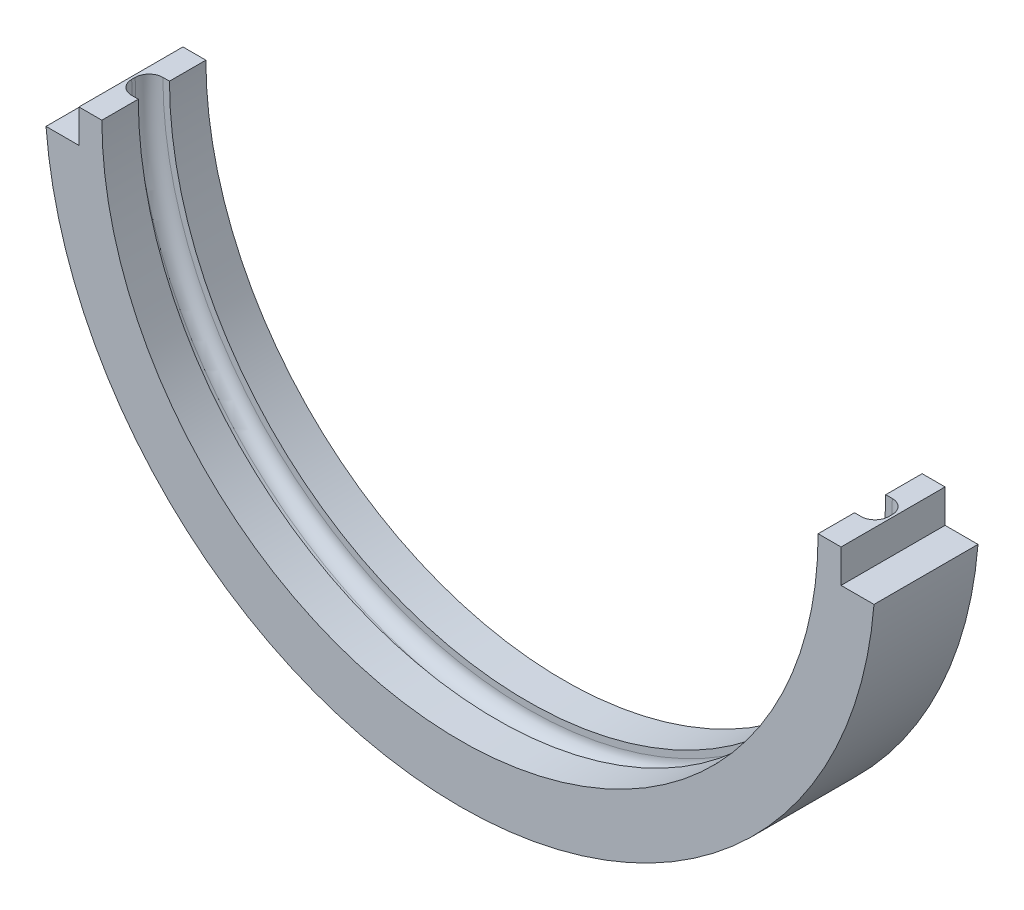
from build123d import *

# Parameters (mm, degrees)
BOSS_EXTRUDE1_DEPTH = 5.715
BOSS_EXTRUDE2_DEPTH = 6.6675
BOSS_EXTRUDE3_START = 6.6675
BOSS_EXTRUDE3_DEPTH = 6.6675
FILLET1_R           = 2.54
SKETCH5_R           = 1.524
CUT_EXTRUDE1_DEPTH  = 6.35
SKETCH6_W           = 6.0325
SKETCH6_H           = 6.096
CUT_EXTRUDE2_DEPTH  = 110.257060148
SKETCH7_W           = 13.176307298
SKETCH7_H           = 9.310122243
CUT_EXTRUDE3_DEPTH  = 110.257060009


with BuildPart() as part:
    # Sketch1 → Boss-Extrude1 (new body)
    with BuildSketch(Plane.XY):
        with BuildLine():
            ThreePointArc((69.342, 76.073), (0, 6.731), (-69.342, 76.073))
            Line((-69.342, 76.073), (-76.073, 76.073))
            ThreePointArc((-76.073, 76.073), (0, 0), (76.073, 76.073))
            Line((76.073, 76.073), (69.342, 76.073))
        make_face()
    extrude(amount=BOSS_EXTRUDE1_DEPTH)

    # Sketch3 → Boss-Extrude2 (add)
    with BuildSketch(Plane.XY.offset(5.715)):
        with BuildLine():
            ThreePointArc((65.5955, 76.073), (0, 10.4775), (-65.5955, 76.073))
            Line((-65.5955, 76.073), (-69.342, 76.073))
            ThreePointArc((-69.342, 76.073), (0, 6.731), (69.342, 76.073))
            Line((69.342, 76.073), (65.5955, 76.073))
        make_face()
        with BuildLine():
            Line((76.073, 76.073), (69.342, 76.073))
            ThreePointArc((69.342, 76.073), (0, 6.731), (-69.342, 76.073))
            Line((-69.342, 76.073), (-76.073, 76.073))
            ThreePointArc((-76.073, 76.073), (0, 0), (76.073, 76.073))
        make_face()
    extrude(amount=BOSS_EXTRUDE2_DEPTH)

    # Sketch4 → Boss-Extrude3 (add)
    with BuildSketch(Plane(origin=(0, 0, 0), x_dir=(-1, 0, 0), z_dir=(0, 0, -1)).offset(BOSS_EXTRUDE3_START)):
        with BuildLine():
            ThreePointArc((65.5955, 76.073), (0, 10.4775), (-65.5955, 76.073))
            Line((-65.5955, 76.073), (-69.342, 76.073))
            ThreePointArc((-69.342, 76.073), (0, 6.731), (69.342, 76.073))
            Line((69.342, 76.073), (65.5955, 76.073))
        make_face()
        with BuildLine():
            Line((76.073, 76.073), (69.342, 76.073))
            ThreePointArc((69.342, 76.073), (0, 6.731), (-69.342, 76.073))
            Line((-69.342, 76.073), (-76.073, 76.073))
            ThreePointArc((-76.073, 76.073), (0, 0), (76.073, 76.073))
        make_face()
    extrude(amount=-BOSS_EXTRUDE3_DEPTH)

    # Fillet1
    fillet1_edges = [part.edges().sort_by_distance(p)[0] for p in [
        (0, 6.731, 5.715),
        (0, 6.731, 0),
    ]]
    fillet(fillet1_edges, radius=FILLET1_R)

    # Sketch5 → Cut-Extrude1 (cut)
    with BuildSketch(Plane(origin=(0, 0, 0), x_dir=(1, 0, 0), z_dir=(0, 1, 0))):
        with Locations(Location((0, -2.8575, 0), (0, 0, 90))):
            Circle(SKETCH5_R)
    extrude(amount=CUT_EXTRUDE1_DEPTH, mode=Mode.SUBTRACT)

    # Sketch6 → Cut-Extrude2 (cut, through all)
    with BuildSketch(Plane.XY.offset(12.3825)):
        with BuildLine():
            Line((-82.07762594, 69.977), (-75.828359556, 69.977))
            ThreePointArc((-75.828359556, 69.977), (-76.011815284, 73.022546552), (-76.073, 76.073))
            Line((-76.073, 76.073), (-82.07762594, 76.073))
            Line((-82.07762594, 76.073), (-82.07762594, 69.977))
        make_face()
        with Locations((-72.812109556, 73.025)):
            Rectangle(SKETCH6_W, SKETCH6_H)
        with BuildLine():
            ThreePointArc((76.073, 76.073), (76.011815284, 73.022546552), (75.828359556, 69.977))
            Line((75.828359556, 69.977), (82.07762594, 69.977))
            Line((82.07762594, 69.977), (82.07762594, 76.073))
            Line((82.07762594, 76.073), (76.073, 76.073))
        make_face()
        with Locations((72.812109556, 73.025)):
            Rectangle(SKETCH6_W, SKETCH6_H)
    extrude(amount=-CUT_EXTRUDE2_DEPTH, mode=Mode.SUBTRACT)


with BuildPart() as cut_extrude2_piece_1:
    # of the separate pieces the step leaves, piece 1, a body of its own (cut_extrude2_pieces)
    add(part.part.solids().sort_by_distance((66.802, 76.073, 5.715))[0])


with BuildPart() as cut_extrude2_piece_2:
    # of the separate pieces the step leaves, piece 2, a body of its own (cut_extrude2_pieces)
    add(part.part.solids().sort_by_distance((75.828359556, 76.073, 12.3825))[0])


with BuildPart() as cut_extrude2_piece_3:
    # of the separate pieces the step leaves, piece 3, a body of its own (cut_extrude2_pieces)
    add(part.part.solids().sort_by_distance((-76.073, 76.073, 12.3825))[0])


with BuildPart() as cut_extrude3_tool:
    # Sketch7 → Cut-Extrude3 (new, through all)
    with BuildSketch(Plane.XY.offset(12.3825)):
        with Locations((-79.400263205, 74.632061122)):
            Rectangle(SKETCH7_W, SKETCH7_H)
        with Locations((79.400263205, 74.632061122)):
            Rectangle(SKETCH7_W, SKETCH7_H)
    extrude(amount=-CUT_EXTRUDE3_DEPTH)


with BuildPart() as cut_extrude2_piece_2_1:
    add(cut_extrude2_piece_2.part)

    # Cut-Extrude3: cut by cut_extrude3_tool
    add(cut_extrude3_tool.part, mode=Mode.SUBTRACT)


with BuildPart() as cut_extrude2_piece_3_1:
    add(cut_extrude2_piece_3.part)

    # Cut-Extrude3: cut by cut_extrude3_tool
    add(cut_extrude3_tool.part, mode=Mode.SUBTRACT)


solid = cut_extrude2_piece_1.part
